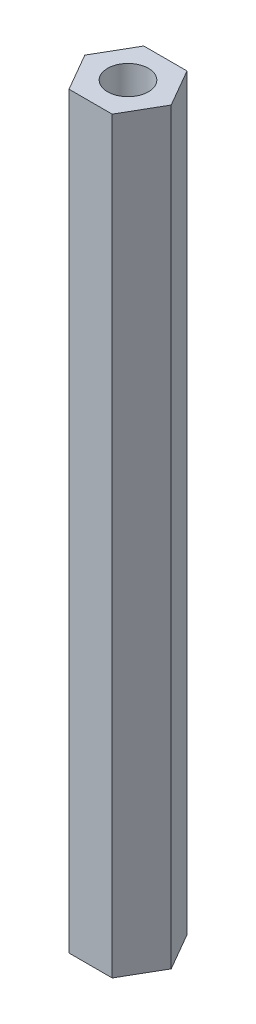
from build123d import *

# Parameters (mm, degrees)
BOSS_EXTRUDE1_DEPTH = 55
SKETCH2_R           = 1.5
CUT_EXTRUDE1_DEPTH  = 10


with BuildPart() as part:
    # Sketch1 → Boss-Extrude1 (new body)
    with BuildSketch(Plane(origin=(0, 0, 0), x_dir=(1, 0, 0), z_dir=(0, 1, 0))):
        Polygon((3.175426481, 0), (1.58771324, 2.75), (-1.58771324, 2.75), (-3.175426481, 0), (-1.58771324, -2.75), (1.58771324, -2.75), align=None)
    extrude(amount=BOSS_EXTRUDE1_DEPTH)

    # Sketch2 → Cut-Extrude1 (cut)
    with BuildSketch(Plane(origin=(0, 55, 0), x_dir=(1, 0, 0), z_dir=(0, 1, 0))):
        with Locations(Location((0, 0, 0), (0, 0, 270))):
            Circle(SKETCH2_R)
    cut_extrude1 = extrude(amount=-CUT_EXTRUDE1_DEPTH, mode=Mode.SUBTRACT)

    # Mirror1: Cut-Extrude1 across plane
    add(cut_extrude1.mirror(Plane(origin=(0, 27.5, 0), x_dir=(0, 0, 1), z_dir=(0, -1, 0))), mode=Mode.SUBTRACT)


solid = part.part
